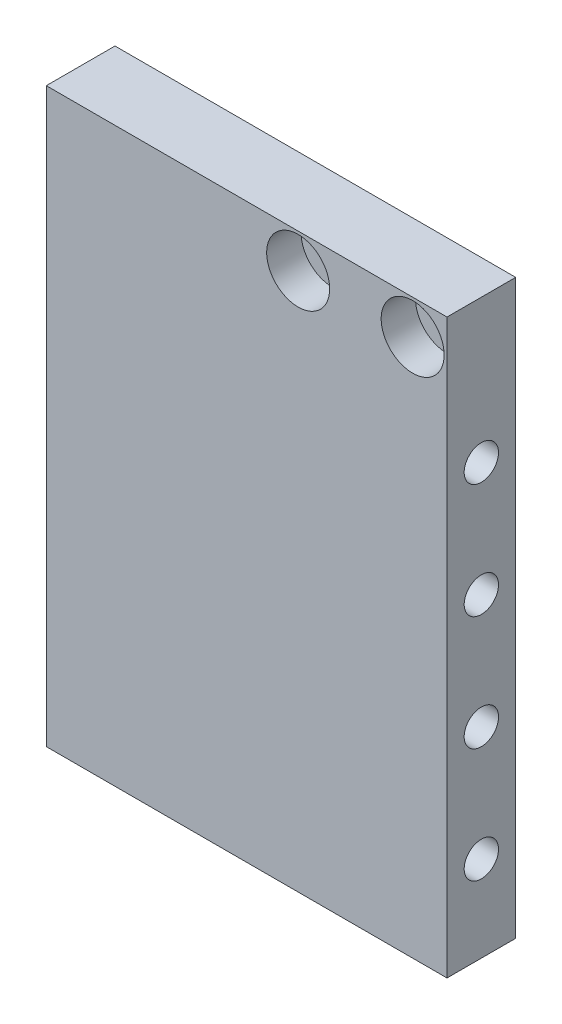
from build123d import *

# Parameters (mm, degrees)
SKETCH_1_W          = 70
SKETCH_1_H          = 100
EXTRUDE_1_DEPTH     = 12
SKETCH_2_R          = 3
CUT_EXTRUDE_1_DEPTH = 10
SKETCH_3_R          = 3
CUT_EXTRUDE_2_DEPTH = 12
SKETCH_4_R          = 5.5
CUT_EXTRUDE_3_DEPTH = 6
CUT_EXTRUDE_START   = -10
SKETCH_5_R          = 3
CUT_EXTRUDE_4_DEPTH = 10
SKETCH_6_R          = 3
CUT_EXTRUDE_5_DEPTH = 10


with BuildPart() as part:
    # 草图1 → 凸台-拉伸1 (new body)
    with BuildSketch(Plane.XY):
        Rectangle(SKETCH_1_W, SKETCH_1_H)
    extrude(amount=EXTRUDE_1_DEPTH)

    # 草图2 → 切除-拉伸1 (cut)
    with BuildSketch(Plane.ZY.offset(35)):
        with Locations((6, -35)):
            Circle(SKETCH_2_R)
        with Locations((6, -15)):
            Circle(SKETCH_2_R)
        with Locations((6, 5)):
            Circle(SKETCH_2_R)
        with Locations((6, 25)):
            Circle(SKETCH_2_R)
    extrude(amount=-CUT_EXTRUDE_1_DEPTH, mode=Mode.SUBTRACT)

    # 草图3 → 切除-拉伸2 (cut)
    with BuildSketch(Plane.XY.offset(12)):
        with Locations((9, 44)):
            Circle(SKETCH_3_R)
        with Locations((29, 44)):
            Circle(SKETCH_3_R)
    extrude(amount=-CUT_EXTRUDE_2_DEPTH, mode=Mode.SUBTRACT)

    # 草图4 → 切除-拉伸3 (cut)
    with BuildSketch(Plane.XY.offset(12)):
        with Locations((9, 44)):
            Circle(SKETCH_4_R)
        with Locations((29, 44)):
            Circle(SKETCH_4_R)
    extrude(amount=-CUT_EXTRUDE_3_DEPTH, mode=Mode.SUBTRACT)

    # 草图5 → 切除-拉伸4 (cut)
    with BuildSketch(Plane(origin=(35, 0, 0), x_dir=(0, 0, -1), z_dir=(1, 0, 0)).offset(CUT_EXTRUDE_START)):
        with Locations(Location((-6, -35, 0), (0, 0, 180))):
            Circle(SKETCH_5_R)
        with Locations(Location((-6, -15, 0), (0, 0, 180))):
            Circle(SKETCH_5_R)
        with Locations(Location((-6, 5, 0), (0, 0, 180))):
            Circle(SKETCH_5_R)
        with Locations(Location((-6, 25, 0), (0, 0, 180))):
            Circle(SKETCH_5_R)
    extrude(amount=CUT_EXTRUDE_4_DEPTH, mode=Mode.SUBTRACT)

    # 草图6 → 切除-拉伸5 (cut)
    with BuildSketch(Plane.XZ.offset(50)):
        with Locations((-21, 6)):
            Circle(SKETCH_6_R)
        with Locations((-7, 6)):
            Circle(SKETCH_6_R)
        with Locations((7, 6)):
            Circle(SKETCH_6_R)
        with Locations((21, 6)):
            Circle(SKETCH_6_R)
    extrude(amount=-CUT_EXTRUDE_5_DEPTH, mode=Mode.SUBTRACT)


solid = part.part
